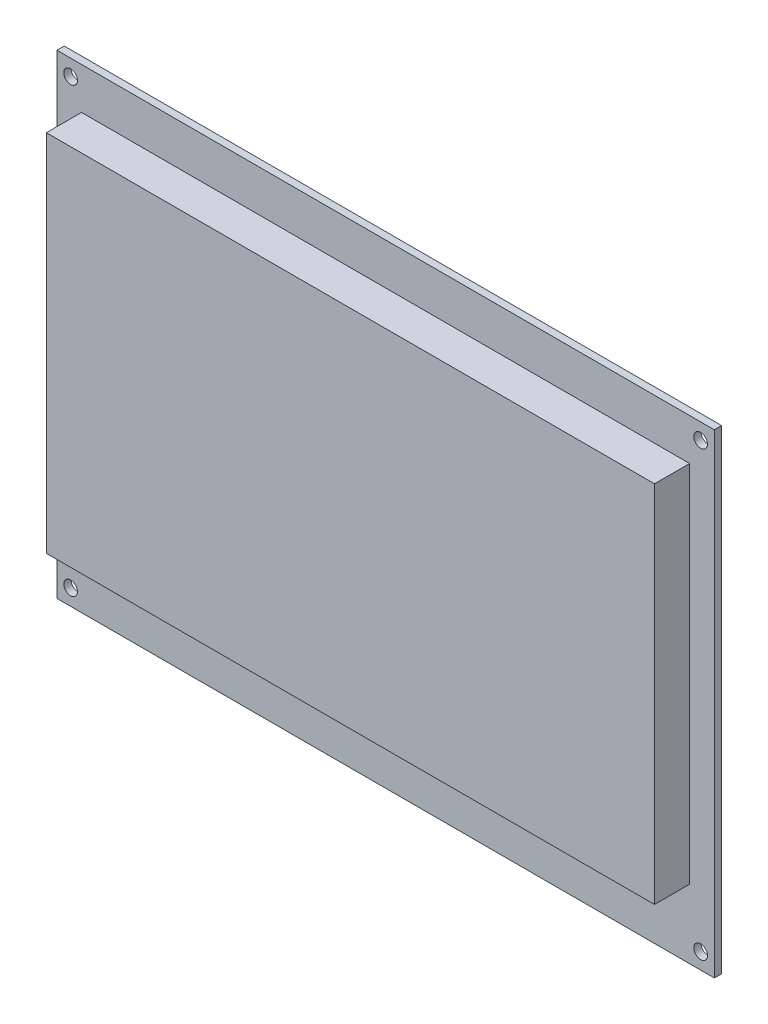
from build123d import *

# Parameters (mm, degrees)
SKETCH_1_W      = 144
SKETCH_1_H      = 104
SKETCH_1_R      = 1.5
SKETCH_1_W_2    = 133.2
SKETCH_1_H_2    = 79.8
EXTRUDE_1_DEPTH = 1.6
SKETCH_2_W      = 133.2
SKETCH_2_H      = 79.8
EXTRUDE_2_DEPTH = 9.3


with BuildPart() as part:
    # 草图1 → 拉伸1 (new body)
    with BuildSketch(Plane.XY):
        Rectangle(SKETCH_1_W, SKETCH_1_H)
        with Locations((-69, -48.5)):
            Circle(SKETCH_1_R, mode=Mode.SUBTRACT)
        with Locations((-69, 48.5)):
            Circle(SKETCH_1_R, mode=Mode.SUBTRACT)
        with Locations((69, 48.5)):
            Circle(SKETCH_1_R, mode=Mode.SUBTRACT)
        with Locations((69, -48.5)):
            Circle(SKETCH_1_R, mode=Mode.SUBTRACT)
        with Locations((0, 3)):
            Rectangle(SKETCH_1_W_2, SKETCH_1_H_2, mode=Mode.SUBTRACT)
    extrude(amount=EXTRUDE_1_DEPTH)

    # 草图2 → 拉伸2 (add)
    with BuildSketch(Plane(origin=(0, 0, 0), x_dir=(-1, 0, 0), z_dir=(0, 0, -1))):
        with Locations((0, 3)):
            Rectangle(SKETCH_2_W, SKETCH_2_H)
    extrude(amount=-EXTRUDE_2_DEPTH)


solid = part.part
